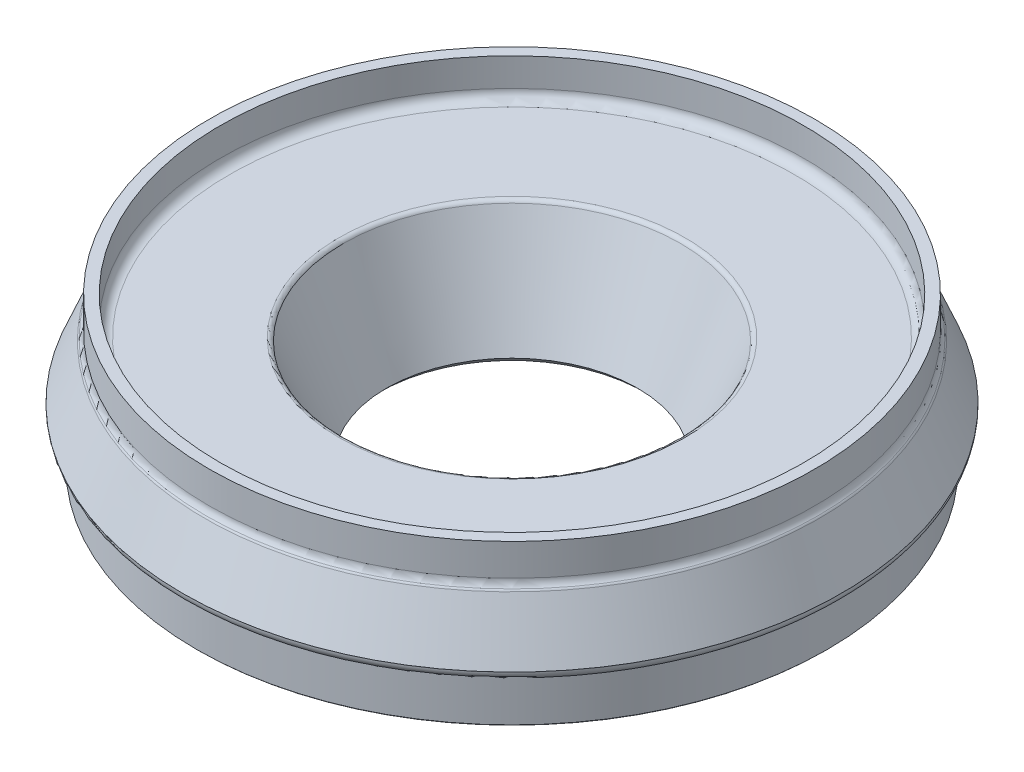
from build123d import *

# Parameters (mm, degrees)
FILLET_2_R          = 0.05
SKETCH_6_R          = 3.217657182
SKETCH_6_R_2        = 3.1
EXTRUDE_1_DEPTH     = 0.4
FILLET_4_R          = 0.1
CHAMFER_1_SIZE      = 0.1
CHAMFER_1_SIZE2     = 0.076501692
SKETCH_7_R          = 3.5
SKETCH_7_R_2        = 3.35
CUT_EXTRUDE_3_DEPTH = 0.5
CHAMFER_2_SIZE      = 0.01
FILLET_6_R          = 0.1


with BuildPart() as part:
    # 草图2 → 旋转1 (revolve)
    with BuildSketch(Plane.XY, mode=Mode.PRIVATE) as revolve_1_sk:
        Polygon((-0.5, 0), (0, 0), (1.695, 0), (1.695, 0.601670643), (1.446081598, 1.203341286), (0, 1.203341286), align=None)
    revolve(revolve_1_sk.sketch.rotate(Axis((-1.805, 0, 0), (0, 1, 0)), 90), axis=Axis((-1.805, 0, 0), (0, 1, 0)))

    # 圆角2
    fillet_2_edges = [part.edges().sort_by_distance(p)[0] for p in [
        (-1.805, 1.203341286, 1.805),
        (-1.805, 1.203341286, 3.251081598),
    ]]
    fillet(fillet_2_edges, radius=FILLET_2_R)

    # 草图6 → 凸台-拉伸1 (add)
    with BuildSketch(Plane(origin=(0, 1.203341286, 0), x_dir=(1, 0, 0), z_dir=(0, 1, 0))):
        with Locations(Location((-1.805, 0, 0), (0, 0, 270))):
            Circle(SKETCH_6_R)
        with Locations(Location((-1.805, 0, 0), (0, 0, 270))):
            Circle(SKETCH_6_R_2, mode=Mode.SUBTRACT)
    extrude(amount=EXTRUDE_1_DEPTH)

    # 圆角4
    fillet_4_edges = [part.edges().sort_by_distance(p)[0] for p in [
        (-5.022657182, 1.203341286, 0),
        (-1.805, 1.203341286, -3.1),
    ]]
    fillet(fillet_4_edges, radius=FILLET_4_R)

    # 倒角1
    chamfer_1_edges = [part.edges().sort_by_distance(p)[0] for p in [
        (-1.805, 0, 1.305),
    ]]
    chamfer_1_side = [part.faces().sort_by_distance(p)[0] for p in [
        (-1.805, 0, 1.403994949),
    ]]
    chamfer(chamfer_1_edges, length=CHAMFER_1_SIZE, length2=CHAMFER_1_SIZE2, reference=chamfer_1_side[0])

    # 草图7 → 切除-拉伸3 (cut)
    with BuildSketch(Plane(origin=(0, 0.5, 0), x_dir=(1, 0, 0), z_dir=(0, 1, 0))):
        with Locations(Location((-1.805, 0, 0), (0, 0, 90))):
            Circle(SKETCH_7_R)
        with Locations(Location((-1.805, 0, 0), (0, 0, 270))):
            Circle(SKETCH_7_R_2, mode=Mode.SUBTRACT)
    extrude(amount=-CUT_EXTRUDE_3_DEPTH, mode=Mode.SUBTRACT)

    # 倒角2
    chamfer_2_edges = [part.edges().sort_by_distance(p)[0] for p in [
        (-1.805, 0, -3.35),
        (-1.805, 0.5, -3.35),
    ]]
    chamfer(chamfer_2_edges, length=CHAMFER_2_SIZE)

    # 圆角6
    fillet_6_edges = [part.edges().sort_by_distance(p)[0] for p in [
        (-1.805, 0.5, 3.5),
    ]]
    fillet(fillet_6_edges, radius=FILLET_6_R)


solid = part.part
